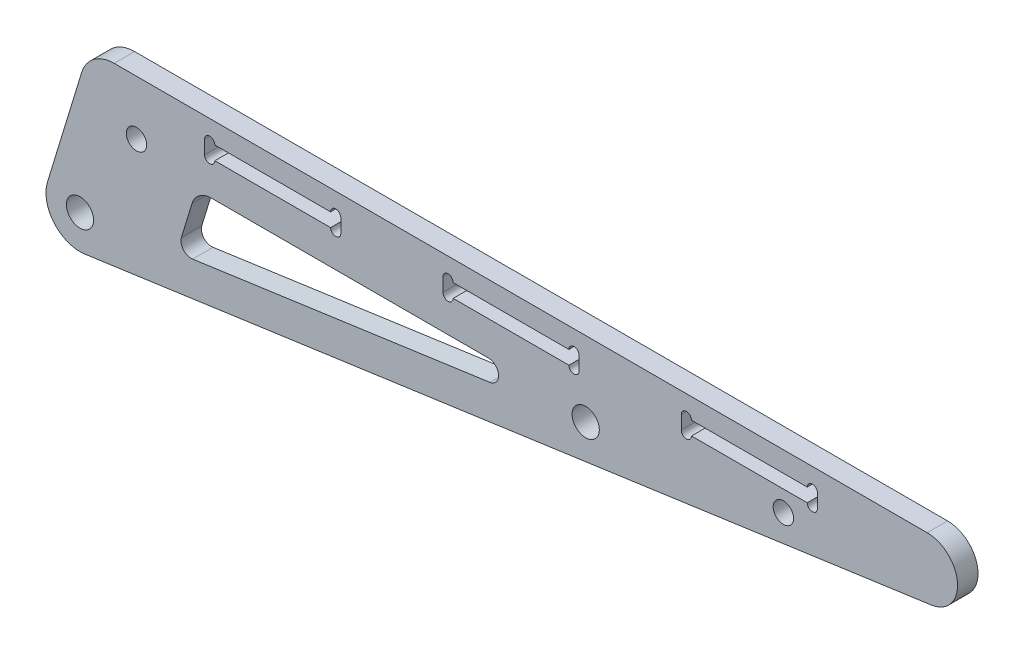
from build123d import *

# Parameters (mm, degrees)
SKETCH_2_R          = 2
SKETCH_2_R_2        = 1.5
SKETCH_2_W          = 20
SKETCH_2_H          = 2
EXTRUDE_1_DEPTH     = 3
SKETCH_3_R          = 0.75
CUT_EXTRUDE_1_DEPTH = 141.027398671
FILLET_1_R          = 5


with BuildPart() as part:
    # 草图2 → 凸台-拉伸1 (new body)
    with BuildSketch(Plane.XY):
        with BuildLine():
            Line((-132.601963201, -4.701034703), (-8.26765697, 12.828618462))
            ThreePointArc((-8.26765697, 12.828618462), (-4.434509027, 17.565346586), (-8.891400832, 21.720551987))
            Line((-8.891400832, 21.720551987), (-131.973846298, 21.720551987))
            Line((-131.973846298, 21.720551987), (-138.082164404, 1.709761493))
            ThreePointArc((-138.082164404, 1.709761493), (-137.100605417, -2.998907272), (-132.601963201, -4.701034703))
        make_face()
        with Locations((-59.03447946, 10.720551987)):
            Circle(SKETCH_2_R, mode=Mode.SUBTRACT)
        with Locations((-133.3, 0.25)):
            Circle(SKETCH_2_R, mode=Mode.SUBTRACT)
        with Locations((-125, 13.720551987)):
            Circle(SKETCH_2_R_2, mode=Mode.SUBTRACT)
        with Locations((-30, 13.720551987)):
            Circle(SKETCH_2_R_2, mode=Mode.SUBTRACT)
        with Locations((-70, 17.720551987)):
            Rectangle(SKETCH_2_W, SKETCH_2_H, mode=Mode.SUBTRACT)
        with Locations((-105, 17.720551987)):
            Rectangle(SKETCH_2_W, SKETCH_2_H, mode=Mode.SUBTRACT)
        with Locations((-35, 17.720551987)):
            Rectangle(SKETCH_2_W, SKETCH_2_H, mode=Mode.SUBTRACT)
    extrude(amount=EXTRUDE_1_DEPTH)

    # 草图3 → 切除-拉伸1 (cut, through all)
    with BuildSketch(Plane.XY.offset(3)):
        with Locations((-114.25, 18.720551987)):
            Circle(SKETCH_3_R)
        with Locations((-114.25, 16.720551987)):
            Circle(SKETCH_3_R)
        with Locations((-95.75, 18.720551987)):
            Circle(SKETCH_3_R)
        with Locations((-95.75, 16.720551987)):
            Circle(SKETCH_3_R)
        with Locations((-79.25, 18.720551987)):
            Circle(SKETCH_3_R)
        with Locations((-79.25, 16.720551987)):
            Circle(SKETCH_3_R)
        with Locations((-60.75, 18.720551987)):
            Circle(SKETCH_3_R)
        with Locations((-60.75, 16.720551987)):
            Circle(SKETCH_3_R)
        with Locations((-44.25, 18.720551987)):
            Circle(SKETCH_3_R)
        with Locations((-44.25, 16.720551987)):
            Circle(SKETCH_3_R)
        with Locations((-25.75, 18.720551987)):
            Circle(SKETCH_3_R)
        with Locations((-25.75, 16.720551987)):
            Circle(SKETCH_3_R)
        with BuildLine():
            Line((-116.854825567, 9.596408883), (-118.409147877, 4.504464164))
            ThreePointArc((-118.409147877, 4.504464164), (-118.114680182, 3.091863534), (-116.765087517, 2.581225305))
            Line((-116.765087517, 2.581225305), (-73.115887133, 8.735241576))
            ThreePointArc((-73.115887133, 8.735241576), (-71.828975077, 10.325514799), (-73.325298173, 11.720551987))
            Line((-73.325298173, 11.720551987), (-113.985526924, 11.720551987))
            ThreePointArc((-113.985526924, 11.720551987), (-115.770524027, 11.13173123), (-116.854825567, 9.596408883))
        make_face()
    extrude(amount=-CUT_EXTRUDE_1_DEPTH, mode=Mode.SUBTRACT)

    # 圆角1
    fillet_1_edges = [part.edges().sort_by_distance(p)[0] for p in [
        (-131.973846298, 21.720551987, 1.5),
    ]]
    fillet(fillet_1_edges, radius=FILLET_1_R)


solid = part.part
